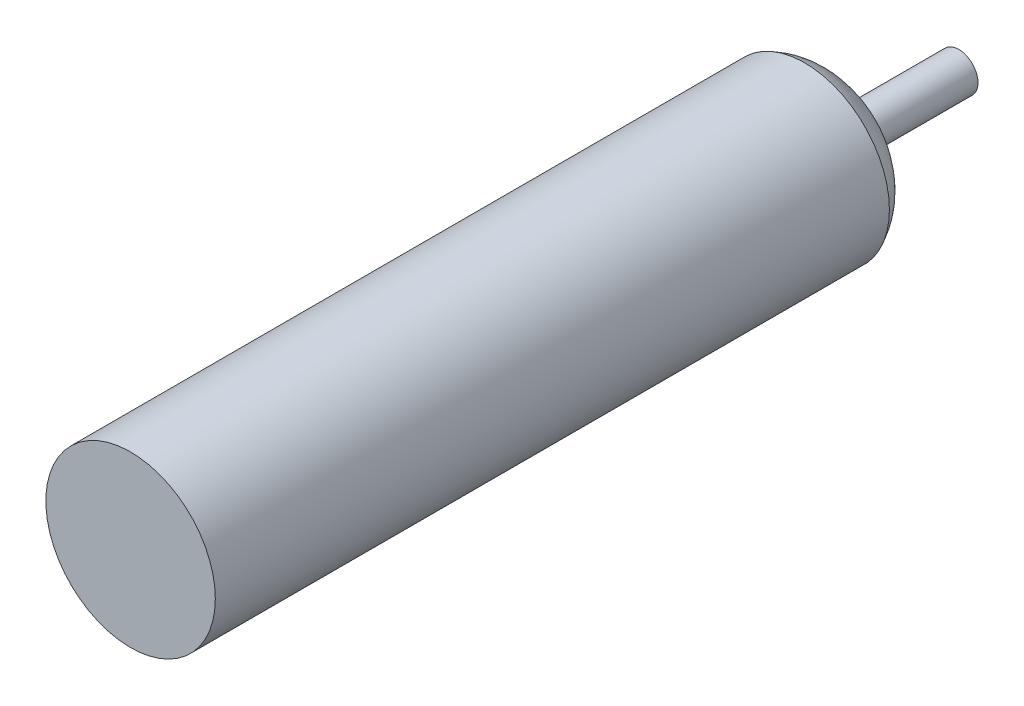
from build123d import *

# Parameters (mm, degrees)
SKETCH1_R           = 55.88
BOSS_EXTRUDE1_DEPTH = 444.5
SKETCH4_R           = 12.7
BOSS_EXTRUDE3_DEPTH = 76.2


with BuildPart() as part:
    # Sketch1 → Boss-Extrude1 (new body)
    with BuildSketch(Plane.XY):
        Circle(SKETCH1_R)
    extrude(amount=BOSS_EXTRUDE1_DEPTH)

    # Sketch3 → Revolve1 (revolve)
    with BuildSketch(Plane(origin=(0, 0, 0), x_dir=(0, 0, -1), z_dir=(1, 0, 0)), mode=Mode.PRIVATE) as revolve1_sk:
        with BuildLine():
            Line((25.4, -12.7), (25.4, 0))
            Line((25.4, 0), (0, 0))
            Line((0, 0), (0, -55.88))
            ThreePointArc((0, -55.88), (19.362446334, -38.209086079), (25.4, -12.7))
        make_face()
    revolve(revolve1_sk.sketch.rotate(Axis((0, 0, 0), (0, 0, -1)), 270), axis=Axis((0, 0, 0), (0, 0, -1)))

    # Sketch4 → Boss-Extrude3 (add)
    with BuildSketch(Plane(origin=(0, 0, -25.4), x_dir=(-1, 0, 0), z_dir=(0, 0, -1))):
        with Locations(Location((0, 0, 0), (0, 0, 180))):
            Circle(SKETCH4_R)
    extrude(amount=BOSS_EXTRUDE3_DEPTH)


solid = part.part
